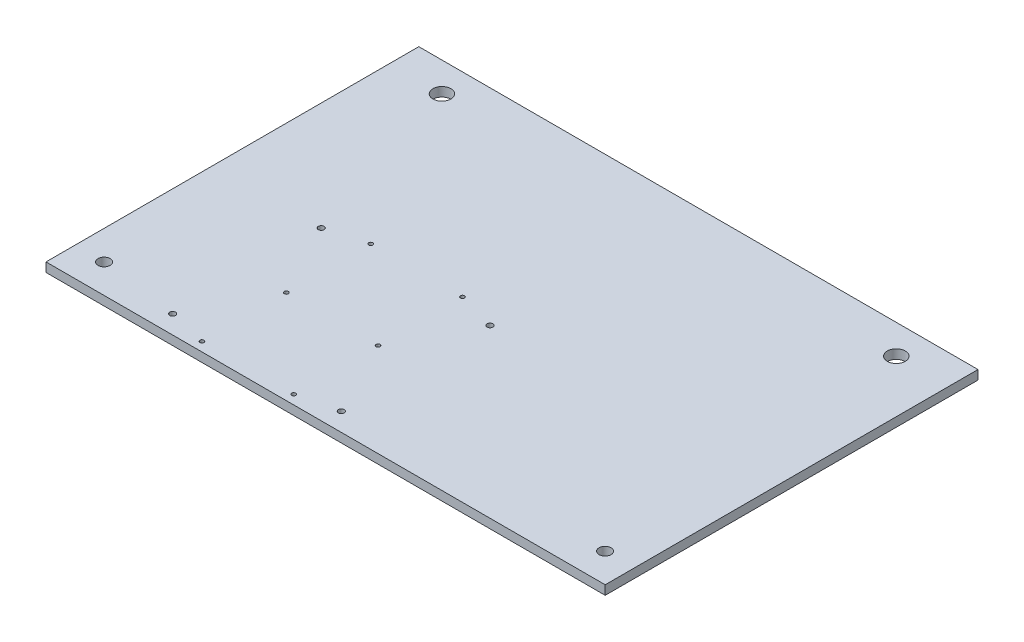
from build123d import *

# Parameters (mm, degrees)
SKETCH1_W                       = 304.8
SKETCH1_H                       = 203.2
BOSS_EXTRUDE1_DEPTH             = 5
CLEARANCE_HOLES_FOR_LED_PANEL_D = 2.2
M3_CLEARANCE_HOLE1_D            = 3.2
F_1_4_CLEARANCE_HOLE1_D         = 6.5278
F_3_8_CLEARANCE_HOLE1_D         = 9.8044


with BuildPart() as part:
    # Sketch1 → Boss-Extrude1 (new body)
    with BuildSketch(Plane(origin=(0, 0, 0), x_dir=(1, 0, 0), z_dir=(0, 1, 0))):
        with Locations((152.4, -101.6)):
            Rectangle(SKETCH1_W, SKETCH1_H)
    extrude(amount=BOSS_EXTRUDE1_DEPTH)

    # clearance holes for led panel (through all)
    with Locations(Plane(origin=(0, 5, 0), x_dir=(1, 0, 0), z_dir=(0, 1, 0))):
        with Locations((80, -106.2), (130, -106.2), (130, -152.2), (80, -152.2), (80, -198.2), (130, -198.2)):
            Hole(CLEARANCE_HOLES_FOR_LED_PANEL_D / 2)

    # M3 Clearance Hole1 (through all)
    with Locations(Plane(origin=(0, 5, 0), x_dir=(1, 0, 0), z_dir=(0, 1, 0))):
        with Locations((59, -112.2), (151, -112.2), (151, -193.2), (59, -193.2)):
            Hole(M3_CLEARANCE_HOLE1_D / 2)

    # 1/4 Clearance Hole1 (through all)
    with Locations(Plane(origin=(0, 5, 0), x_dir=(1, 0, 0), z_dir=(0, 1, 0))):
        with Locations((15.875, -187.4139), (288.925, -187.4139)):
            Hole(F_1_4_CLEARANCE_HOLE1_D / 2)

    # 3/8 Clearance Hole1 (through all)
    with Locations(Plane(origin=(0, 5, 0), x_dir=(1, 0, 0), z_dir=(0, 1, 0))):
        with Locations((28.575, -15.9639), (276.225, -15.9639)):
            Hole(F_3_8_CLEARANCE_HOLE1_D / 2)


solid = part.part
